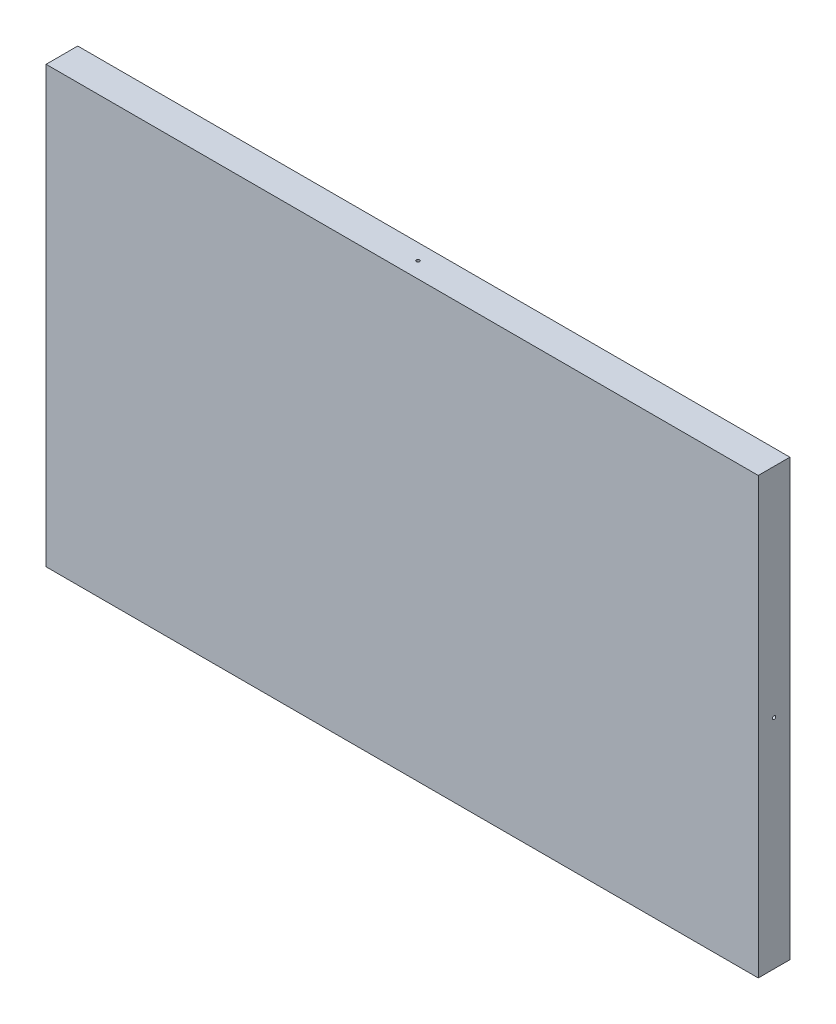
from build123d import *

# Parameters (mm, degrees)
SKETCH_1_W         = 900
SKETCH_1_H         = 550
EXTRUDE_1_DEPTH    = 40
HOLE_WIZARD_M5_1_D = 4.2
HOLE_WIZARD_M5_2_D = 4.2


with BuildPart() as part:
    # 草图1 → 凸台-拉伸1 (new body)
    with BuildSketch(Plane.XY):
        Rectangle(SKETCH_1_W, SKETCH_1_H)
    extrude(amount=EXTRUDE_1_DEPTH)

    # M5 螺纹孔1 (through all)
    with Locations(Plane(origin=(0, 275, 0), x_dir=(1, 0, 0), z_dir=(0, 1, 0))):
        with Locations((0, -20)):
            Hole(HOLE_WIZARD_M5_1_D / 2)

    # M5 螺纹孔2 (through all)
    with Locations(Plane.ZY.offset(450)):
        with Locations((20, 0)):
            Hole(HOLE_WIZARD_M5_2_D / 2)


solid = part.part
